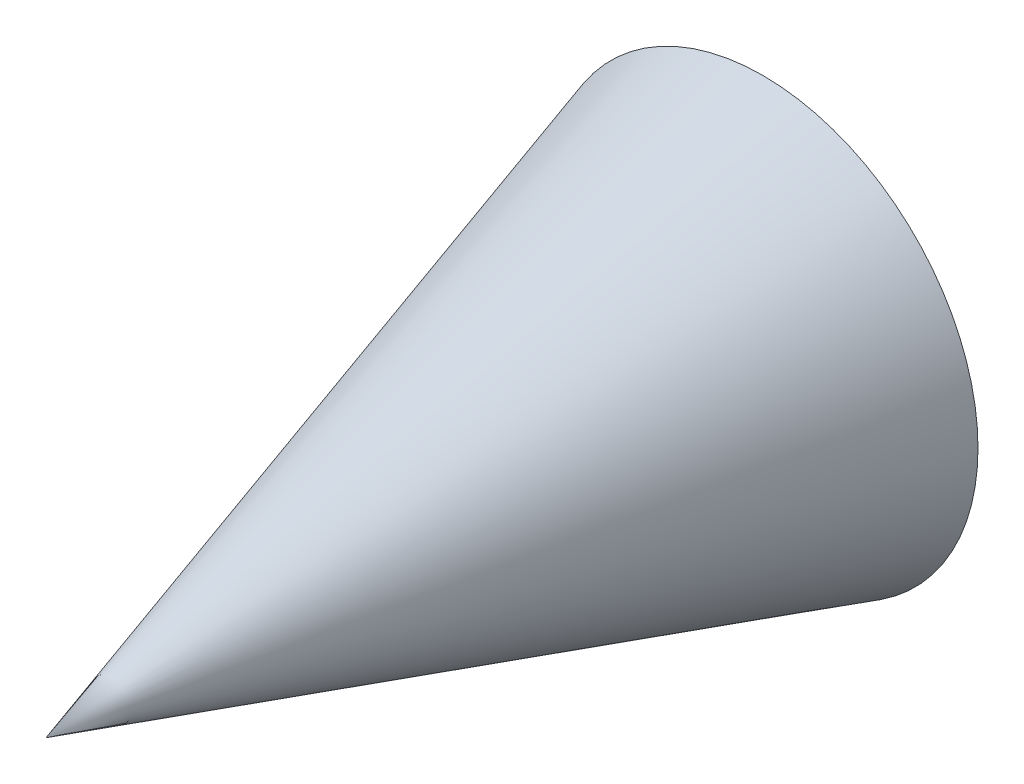
from build123d import *


with BuildPart() as part:
    # Sketch1 → Cone (revolve)
    with BuildSketch(Plane(origin=(0, 0, 0), x_dir=(0, 0, -1), z_dir=(1, 0, 0)), mode=Mode.PRIVATE) as cone_sk:
        Polygon((0, 0), (0, 30), (-100, 0), align=None)
    revolve(cone_sk.sketch.rotate(Axis((0, 0, 0), (0, 0, 1)), 90), axis=Axis((0, 0, 0), (0, 0, 1)))


solid = part.part
